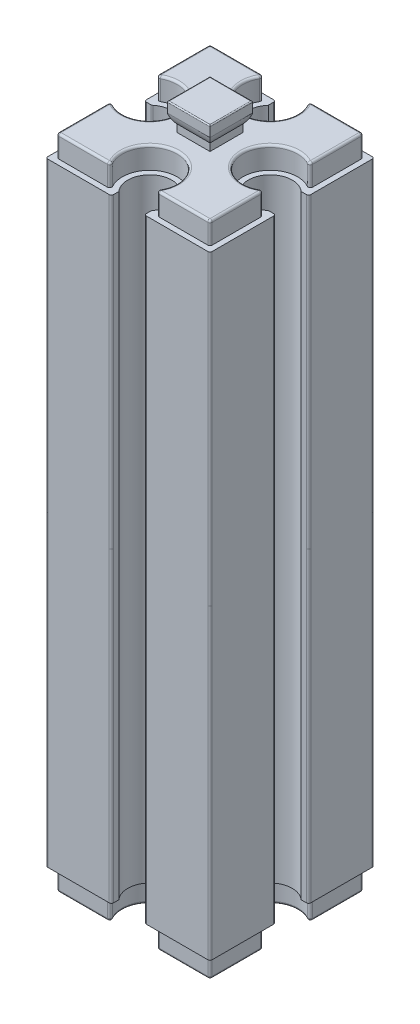
from build123d import *

# Parameters (mm, degrees)
EXTRUDE_1_DEPTH        = 28
EXTRUDE_2_DEPTH        = 2
EXTRUDE_3_DEPTH        = 2
FILLET_3_R             = 0.2
CUT_EXTRUDE_1_DEPTH    = 3
FILLET_4_R             = 0.2
FILLET_5_R             = 0.1
FILLET_3_OF_MIRROR_1_R = 0.2
FILLET_4_OF_MIRROR_1_R = 0.2
FILLET_5_OF_MIRROR_1_R = 0.1


with BuildPart() as part:
    # 草图1 → 凸台-拉伸1 (new body)
    with BuildSketch(Plane(origin=(0, 0, 0), x_dir=(1, 0, 0), z_dir=(0, 1, 0))):
        with BuildLine():
            Line((-7.5, 7.5), (-1.5, 7.5))
            Line((-1.5, 7.5), (-1.5, 6.822875656))
            ThreePointArc((-1.5, 6.822875656), (0, 3.5), (1.5, 6.822875656))
            Line((1.5, 6.822875656), (1.5, 7.5))
            Line((1.5, 7.5), (7.5, 7.5))
            Line((7.5, 7.5), (7.5, 1.5))
            Line((7.5, 1.5), (6.822875656, 1.5))
            ThreePointArc((6.822875656, 1.5), (3.5, 0), (6.822875656, -1.5))
            Line((6.822875656, -1.5), (7.5, -1.5))
            Line((7.5, -1.5), (7.5, -7.5))
            Line((7.5, -7.5), (1.5, -7.5))
            Line((1.5, -7.5), (1.5, -6.822875656))
            ThreePointArc((1.5, -6.822875656), (0, -3.5), (-1.5, -6.822875656))
            Line((-1.5, -6.822875656), (-1.5, -7.5))
            Line((-1.5, -7.5), (-7.5, -7.5))
            Line((-7.5, -7.5), (-7.5, -1.5))
            Line((-7.5, -1.5), (-6.822875656, -1.5))
            ThreePointArc((-6.822875656, -1.5), (-3.5, 0), (-6.822875656, 1.5))
            Line((-6.822875656, 1.5), (-7.5, 1.5))
            Line((-7.5, 1.5), (-7.5, 7.5))
        make_face()
    extrude_1 = extrude(amount=EXTRUDE_1_DEPTH)

    # 草图2 → 凸台-拉伸2 (add)
    with BuildSketch(Plane(origin=(0, 28, 0), x_dir=(1, 0, 0), z_dir=(0, 1, 0))):
        with BuildLine():
            Line((-7, 7), (-7, 2))
            ThreePointArc((-7, 2), (-3, 0), (-7, -2))
            Line((-7, -2), (-7, -7))
            Line((-7, -7), (-2, -7))
            ThreePointArc((-2, -7), (0, -3), (2, -7))
            Line((2, -7), (7, -7))
            Line((7, -7), (7, -2))
            ThreePointArc((7, -2), (3, 0), (7, 2))
            Line((7, 2), (7, 7))
            Line((7, 7), (2, 7))
            ThreePointArc((2, 7), (0, 3), (-2, 7))
            Line((-2, 7), (-7, 7))
        make_face()
    extrude_2 = extrude(amount=EXTRUDE_2_DEPTH)

    # 草图3 → 凸台-拉伸3 (add, symmetric)
    with BuildSketch(Plane(origin=(0, 0, 0), x_dir=(0, 0, -1), z_dir=(1, 0, 0))):
        with BuildLine():
            Line((-1.5, 30), (1.5, 30))
            Line((1.5, 30), (1.5, 30.677124344))
            ThreePointArc((1.5, 30.677124344), (1.780042303, 31.088161527), (1.95, 31.555590279))
            Line((1.95, 31.555590279), (1.95, 32.5))
            Line((1.95, 32.5), (-1.95, 32.5))
            Line((-1.95, 32.5), (-1.95, 31.555590279))
            ThreePointArc((-1.95, 31.555590279), (-1.780042303, 31.088161527), (-1.5, 30.677124344))
            Line((-1.5, 30.677124344), (-1.5, 30))
        make_face()
    extrude_3 = extrude(amount=EXTRUDE_3_DEPTH, both=True)

    # 圆角3
    fillet_3_edges = [part.edges().sort_by_distance(p)[0] for p in [
        (-7.5, 14, -7.5),
        (-1.5, 14, -7.5),
        (1.5, 14, -7.5),
        (7.5, 14, -7.5),
        (7.5, 14, -1.5),
        (7.5, 14, 1.5),
        (7.5, 14, 7.5),
        (1.5, 14, 7.5),
        (-1.5, 14, 7.5),
        (-7.5, 14, 7.5),
        (-7.5, 14, 1.5),
        (-6.822875656, 14, -1.5),
        (-7.5, 14, -1.5),
    ]]
    fillet(fillet_3_edges, radius=FILLET_3_R)

    # 草图4 → 切除-拉伸1 (cut, symmetric)
    with BuildSketch(Plane.XY):
        with BuildLine():
            Line((1.95, 32.5), (2, 32.5))
            Line((2, 32.5), (2, 30))
            Line((2, 30), (1.5, 30))
            Line((1.5, 30), (1.5, 30.677124344))
            ThreePointArc((1.5, 30.677124344), (1.780042303, 31.088161527), (1.95, 31.555590279))
            Line((1.95, 31.555590279), (1.95, 32.5))
        make_face()
        with BuildLine():
            Line((-1.95, 32.5), (-1.95, 31.555590279))
            ThreePointArc((-1.95, 31.555590279), (-1.780042303, 31.088161527), (-1.5, 30.677124344))
            Line((-1.5, 30.677124344), (-1.5, 30))
            Line((-1.5, 30), (-2, 30))
            Line((-2, 30), (-2, 32.5))
            Line((-2, 32.5), (-1.95, 32.5))
        make_face()
    cut_extrude_1 = extrude(amount=CUT_EXTRUDE_1_DEPTH, both=True, mode=Mode.SUBTRACT)

    # 圆角4
    fillet_4_edges = [part.edges().sort_by_distance(p)[0] for p in [
        (-2, 29, -7),
        (-7, 29, -7),
        (-7, 29, -2),
        (-7, 29, 2),
        (-7, 29, 7),
        (-2, 29, 7),
        (2, 29, 7),
        (7, 29, 7),
        (7, 29, 2),
        (7, 29, -2),
        (7, 29, -7),
        (2, 29, -7),
        (-4.5, 30, -7),
        (-7, 30, -4.5),
        (-3, 30, 0),
        (-7, 30, 4.5),
        (-4.5, 30, 7),
        (0, 30, 3),
        (4.5, 30, 7),
        (7, 30, 4.5),
        (3, 30, 0),
        (7, 30, -4.5),
        (4.5, 30, -7),
        (0, 30, -3),
    ]]
    fillet(fillet_4_edges, radius=FILLET_4_R)

    # 圆角5
    fillet_5_edges = [part.edges().sort_by_distance(p)[0] for p in [
        (1.95, 32.5, 0),
        (0, 32.5, -1.95),
        (0, 32.5, 1.95),
        (-1.95, 32.5, 0),
    ]]
    fillet(fillet_5_edges, radius=FILLET_5_R)


with BuildPart() as mirror_1_1:
    # 镜向1: 凸台-拉伸1, 凸台-拉伸2, 凸台-拉伸3 across Top Plane
    add(extrude_1.mirror(Plane(origin=(0, 0, 0), x_dir=(1, 0, 0), z_dir=(0, 1, 0))))
    add(extrude_2.mirror(Plane(origin=(0, 0, 0), x_dir=(1, 0, 0), z_dir=(0, 1, 0))))
    add(extrude_3.mirror(Plane(origin=(0, 0, 0), x_dir=(1, 0, 0), z_dir=(0, 1, 0))))

    # Mirror 1 2: 切除-拉伸1 across Top Plane
    add(cut_extrude_1.mirror(Plane(origin=(0, 0, 0), x_dir=(1, 0, 0), z_dir=(0, 1, 0))), mode=Mode.SUBTRACT)

    # 圆角3 of 镜向1
    fillet_3_of_mirror_1_edges = [mirror_1_1.edges().sort_by_distance(p)[0] for p in [
        (-7.5, -14, -7.5),
        (-1.5, -14, -7.5),
        (1.5, -14, -7.5),
        (7.5, -14, -7.5),
        (7.5, -14, -1.5),
        (7.5, -14, 1.5),
        (7.5, -14, 7.5),
        (1.5, -14, 7.5),
        (-1.5, -14, 7.5),
        (-7.5, -14, 7.5),
        (-7.5, -14, 1.5),
        (-6.822875656, -14, -1.5),
        (-7.5, -14, -1.5),
    ]]
    fillet(fillet_3_of_mirror_1_edges, radius=FILLET_3_OF_MIRROR_1_R)

    # 圆角4 of 镜向1
    fillet_4_of_mirror_1_edges = [mirror_1_1.edges().sort_by_distance(p)[0] for p in [
        (-2, -29, -7),
        (-7, -29, -7),
        (-7, -29, -2),
        (-7, -29, 2),
        (-7, -29, 7),
        (-2, -29, 7),
        (2, -29, 7),
        (7, -29, 7),
        (7, -29, 2),
        (7, -29, -2),
        (7, -29, -7),
        (2, -29, -7),
        (-4.5, -30, -7),
        (-7, -30, -4.5),
        (-3, -30, 0),
        (-7, -30, 4.5),
        (-4.5, -30, 7),
        (0, -30, 3),
        (4.5, -30, 7),
        (7, -30, 4.5),
        (3, -30, 0),
        (7, -30, -4.5),
        (4.5, -30, -7),
        (0, -30, -3),
    ]]
    fillet(fillet_4_of_mirror_1_edges, radius=FILLET_4_OF_MIRROR_1_R)

    # 圆角5 of 镜向1
    fillet_5_of_mirror_1_edges = [mirror_1_1.edges().sort_by_distance(p)[0] for p in [
        (1.95, -32.5, 0),
        (0, -32.5, -1.95),
        (0, -32.5, 1.95),
        (-1.95, -32.5, 0),
    ]]
    fillet(fillet_5_of_mirror_1_edges, radius=FILLET_5_OF_MIRROR_1_R)


with BuildPart() as part_1:
    add(part.part)

    # 镜向1 united with what the copies tou: union 镜向1_1
    add(mirror_1_1.part)


solid = part_1.part
